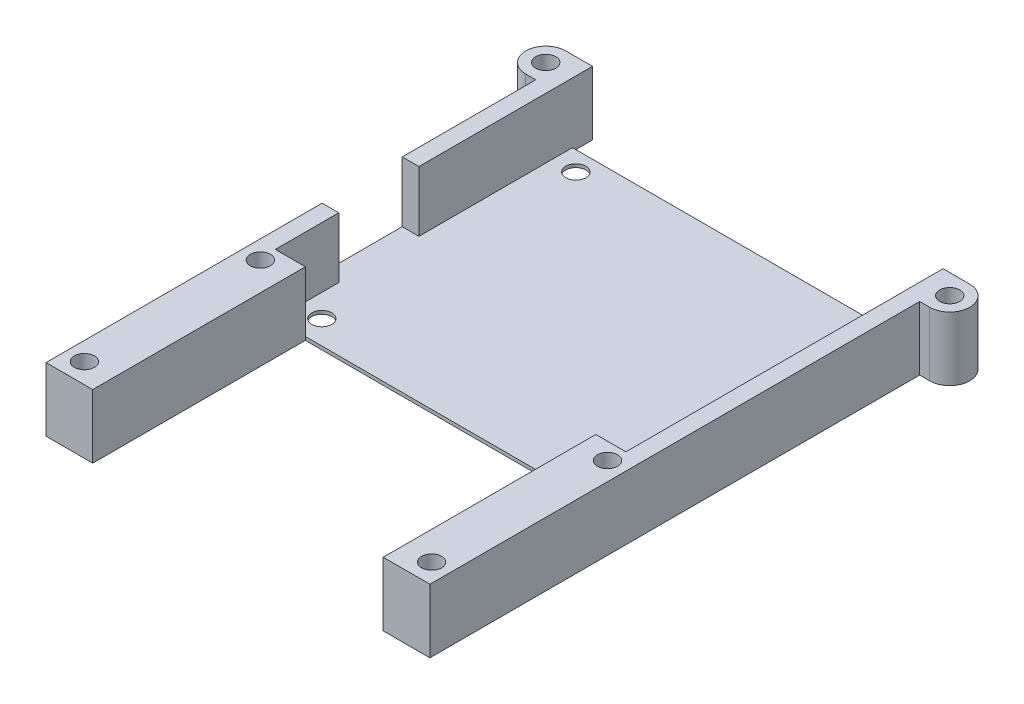
from build123d import *

# Parameters (mm, degrees)
BOSS_EXTRUDE1_DEPTH          = 0.5
BOSS_EXTRUDE2_DEPTH          = 9.55
F_3_0_3_DIAMETER_HOLE1_D     = 3
F_3_0_3_DIAMETER_HOLE1_DEPTH = 12
F_3_0_3_DIAMETER_HOLE1_TIP   = 0.901290929


with BuildPart() as part:
    # Sketch1 → Boss-Extrude1 (new body)
    with BuildSketch(Plane(origin=(0, 0, 0), x_dir=(1, 0, 0), z_dir=(0, 1, 0))):
        Polygon((26.25, 31.85), (26.25, 76.35), (-26.25, 76.35), (-26.25, 53.35), (-28.75, 53.35), (-28.75, 41.35), (-26.25, 41.35), (-26.25, 31.85), align=None)
    extrude(amount=BOSS_EXTRUDE1_DEPTH)

    # Sketch1<3> → Boss-Extrude2 (add)
    with BuildSketch(Plane(origin=(0, 0, 0), x_dir=(1, 0, 0), z_dir=(0, 1, 0))):
        with BuildLine():
            Line((-26.25, 79.35), (-30.25, 79.35))
            ThreePointArc((-30.25, 79.35), (-33.25, 76.35), (-30.25, 73.35))
            Line((-30.25, 73.35), (-28.75, 73.35))
            Line((-28.75, 73.35), (-28.75, 53.35))
            Line((-28.75, 53.35), (-26.25, 53.35))
            Line((-26.25, 53.35), (-26.25, 79.35))
        make_face()
        with BuildLine():
            Line((26.25, 79.35), (26.25, 31.85))
            Line((26.25, 31.85), (21.75, 31.85))
            Line((21.75, 31.85), (21.75, 0))
            Line((21.75, 0), (28.75, 0))
            Line((28.75, 0), (28.75, 73.35))
            Line((28.75, 73.35), (30.25, 73.35))
            ThreePointArc((30.25, 73.35), (33.25, 76.35), (30.25, 79.35))
            Line((30.25, 79.35), (26.25, 79.35))
        make_face()
        Polygon((-26.25, 31.85), (-26.25, 41.35), (-28.75, 41.35), (-28.75, 0), (-21.75, 0), (-21.75, 31.85), align=None)
    extrude(amount=BOSS_EXTRUDE2_DEPTH)

    # Ø3.0 (3) Diameter Hole1
    with Locations(Plane(origin=(0, 0, 0), x_dir=(-1, 0, 0), z_dir=(0, -1, 0))):
        with Locations((-22.85, 73.45), (22.85, 73.45), (26, 29.35), (22.85, 35.4), (-22.85, 35.4), (-26, 29.35), (-26, 3), (26, 3), (-30.25, 76.35), (30.25, 76.35)):
            Hole(F_3_0_3_DIAMETER_HOLE1_D / 2, depth=F_3_0_3_DIAMETER_HOLE1_DEPTH)
            with Locations((0, 0, -(F_3_0_3_DIAMETER_HOLE1_DEPTH + F_3_0_3_DIAMETER_HOLE1_TIP / 2))):  # 118° drill point
                Cone(0, F_3_0_3_DIAMETER_HOLE1_D / 2, F_3_0_3_DIAMETER_HOLE1_TIP, mode=Mode.SUBTRACT)


solid = part.part
